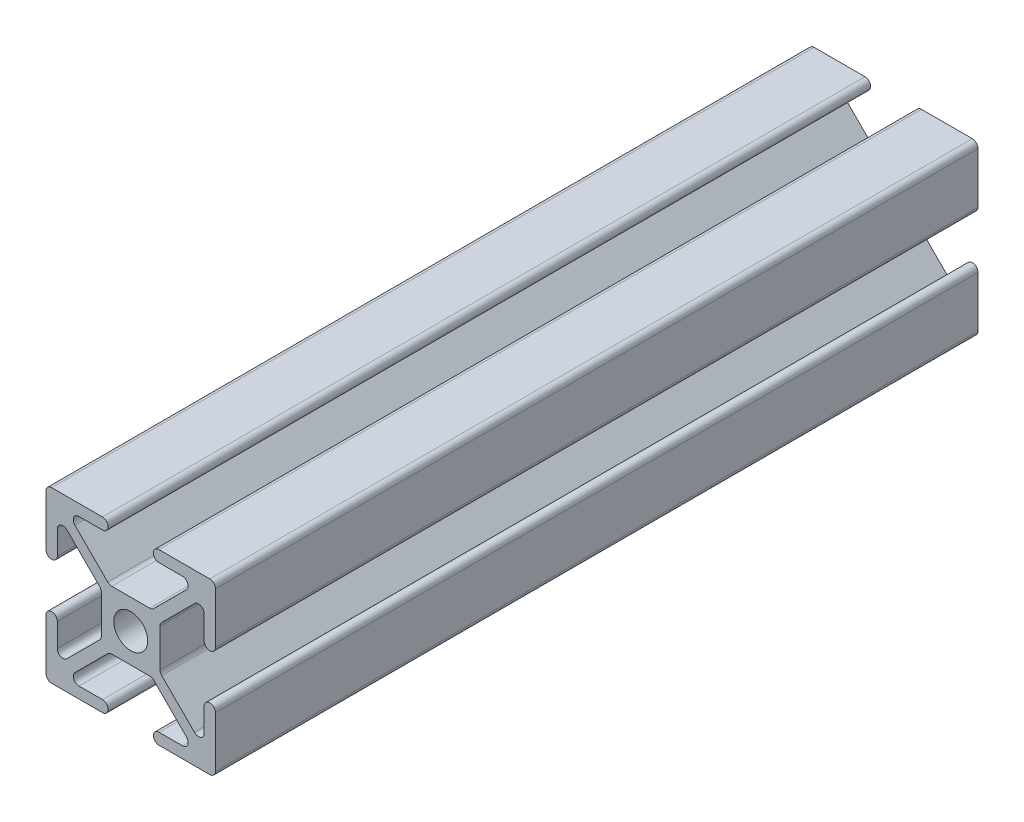
from build123d import *

# Parameters (mm, degrees)
SALIENTE_EXTRUIR1_DEPTH = 190
CROQUIS2_R              = 3
CORTAR_EXTRUIR1_DEPTH   = 192.180542943
CORTAR_EXTRUIR3_DEPTH   = 192.180542943
CROQUIS4_W              = 33.127581221
CROQUIS4_H              = 30
CORTAR_EXTRUIR4_DEPTH   = 38
CROQUIS5_W              = 25
CROQUIS5_H              = 30
CORTAR_EXTRUIR5_DEPTH   = 30


with BuildPart() as part:
    # Croquis1 → Saliente-Extruir1 (new body)
    with BuildSketch(Plane.XY):
        with BuildLine():
            Line((-14, 15), (14, 15))
            ThreePointArc((14, 15), (14.707106781, 14.707106781), (15, 14))
            Line((15, 14), (15, -14))
            ThreePointArc((15, -14), (14.707106781, -14.707106781), (14, -15))
            Line((14, -15), (-14, -15))
            ThreePointArc((-14, -15), (-14.707106781, -14.707106781), (-15, -14))
            Line((-15, -14), (-15, 14))
            ThreePointArc((-15, 14), (-14.707106781, 14.707106781), (-14, 15))
        make_face()
    extrude(amount=-SALIENTE_EXTRUIR1_DEPTH)

    # Croquis2 → Cortar-Extruir1 (cut, through all)
    with BuildSketch(Plane.XY):
        Circle(CROQUIS2_R)
    extrude(amount=-CORTAR_EXTRUIR1_DEPTH, mode=Mode.SUBTRACT)

    # Croquis3 → Cortar-Extruir3 (cut, through all)
    with BuildSketch(Plane.XY):
        with BuildLine():
            Line((-5.492893219, 4.078679656), (-11.292893219, 9.878679656))
            ThreePointArc((-11.292893219, 9.878679656), (-12.382683432, 10.095452408), (-13, 9.171572875))
            Line((-13, 9.171572875), (-13, 5))
            ThreePointArc((-13, 5), (-14, 4), (-15, 5))
            Line((-15, 5), (-15, -5))
            ThreePointArc((-15, -5), (-14, -4), (-13, -5))
            Line((-13, -5), (-13, -9.171572875))
            ThreePointArc((-13, -9.171572875), (-12.382683432, -10.095452408), (-11.292893219, -9.878679656))
            Line((-11.292893219, -9.878679656), (-5.492893219, -4.078679656))
            ThreePointArc((-5.492893219, -4.078679656), (-5.276120467, -3.754256308), (-5.2, -3.371572875))
            Line((-5.2, -3.371572875), (-5.2, 3.371572875))
            ThreePointArc((-5.2, 3.371572875), (-5.276120467, 3.754256308), (-5.492893219, 4.078679656))
        make_face()
        with BuildLine():
            ThreePointArc((-9.171572875, 13), (-10.095452408, 12.382683432), (-9.878679656, 11.292893219))
            Line((-9.878679656, 11.292893219), (-4.078679656, 5.492893219))
            ThreePointArc((-4.078679656, 5.492893219), (-3.754256308, 5.276120467), (-3.371572875, 5.2))
            Line((-3.371572875, 5.2), (3.371572875, 5.2))
            ThreePointArc((3.371572875, 5.2), (3.754256308, 5.276120467), (4.078679656, 5.492893219))
            Line((4.078679656, 5.492893219), (9.878679656, 11.292893219))
            ThreePointArc((9.878679656, 11.292893219), (10.095452408, 12.382683432), (9.171572875, 13))
            Line((9.171572875, 13), (5, 13))
            ThreePointArc((5, 13), (4, 14), (5, 15))
            Line((5, 15), (-5, 15))
            ThreePointArc((-5, 15), (-4.292893219, 14.707106781), (-4, 14))
            ThreePointArc((-4, 14), (-4.292893219, 13.292893219), (-5, 13))
            Line((-5, 13), (-9.171572875, 13))
        make_face()
        with BuildLine():
            Line((9.878679656, -11.292893219), (4.078679656, -5.492893219))
            ThreePointArc((4.078679656, -5.492893219), (3.754256308, -5.276120467), (3.371572875, -5.2))
            Line((3.371572875, -5.2), (-3.371572875, -5.2))
            ThreePointArc((-3.371572875, -5.2), (-3.754256308, -5.276120467), (-4.078679656, -5.492893219))
            Line((-4.078679656, -5.492893219), (-9.878679656, -11.292893219))
            ThreePointArc((-9.878679656, -11.292893219), (-10.095452408, -12.382683432), (-9.171572875, -13))
            Line((-9.171572875, -13), (-5, -13))
            ThreePointArc((-5, -13), (-4.292893219, -13.292893219), (-4, -14))
            ThreePointArc((-4, -14), (-4.292893219, -14.707106781), (-5, -15))
            Line((-5, -15), (5, -15))
            ThreePointArc((5, -15), (4, -14), (5, -13))
            Line((5, -13), (9.171572875, -13))
            ThreePointArc((9.171572875, -13), (10.095452408, -12.382683432), (9.878679656, -11.292893219))
        make_face()
        with BuildLine():
            ThreePointArc((13, 9.171572875), (12.382683432, 10.095452408), (11.292893219, 9.878679656))
            Line((11.292893219, 9.878679656), (5.492893219, 4.078679656))
            ThreePointArc((5.492893219, 4.078679656), (5.276120467, 3.754256308), (5.2, 3.371572875))
            Line((5.2, 3.371572875), (5.2, -3.371572875))
            ThreePointArc((5.2, -3.371572875), (5.276120467, -3.754256308), (5.492893219, -4.078679656))
            Line((5.492893219, -4.078679656), (11.292893219, -9.878679656))
            ThreePointArc((11.292893219, -9.878679656), (12.382683432, -10.095452408), (13, -9.171572875))
            Line((13, -9.171572875), (13, -5))
            ThreePointArc((13, -5), (14, -4), (15, -5))
            Line((15, -5), (15, 5))
            ThreePointArc((15, 5), (14, 4), (13, 5))
            Line((13, 5), (13, 9.171572875))
        make_face()
    extrude(amount=-CORTAR_EXTRUIR3_DEPTH, mode=Mode.SUBTRACT)

    # Croquis4 → Cortar-Extruir4 (cut)
    with BuildSketch(Plane(origin=(0, 15, 0), x_dir=(1, 0, 0), z_dir=(0, 1, 0))):
        with Locations((-1.56379061, 15)):
            Rectangle(CROQUIS4_W, CROQUIS4_H)
    extrude(amount=-CORTAR_EXTRUIR4_DEPTH, mode=Mode.SUBTRACT)

    # Croquis5 → Cortar-Extruir5 (cut)
    with BuildSketch(Plane(origin=(15, 0, 0), x_dir=(0, 0, -1), z_dir=(1, 0, 0))):
        with Locations((42.5, 0)):
            Rectangle(CROQUIS5_W, CROQUIS5_H)
    extrude(amount=-CORTAR_EXTRUIR5_DEPTH, mode=Mode.SUBTRACT)


solid = part.part
